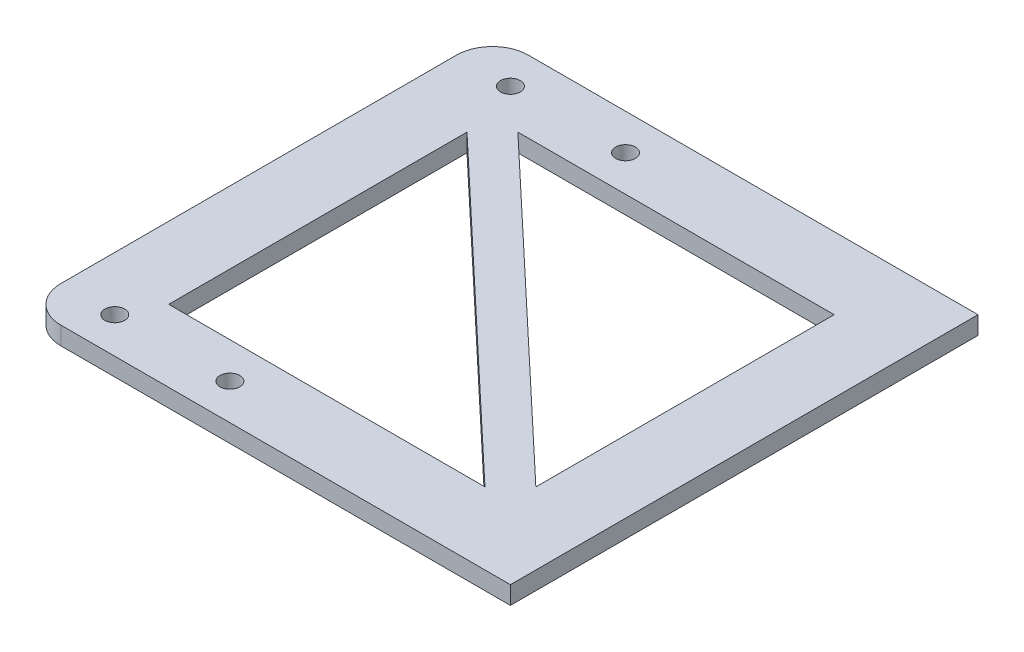
from build123d import *

# Parameters (mm, degrees)
SKETCH1_W           = 135
SKETCH1_H           = 130
SKETCH1_R           = 2.75
BOSS_EXTRUDE2_DEPTH = 5
FILLET1_R           = 10


with BuildPart() as part:
    # Sketch1 → Boss-Extrude2 (new body)
    with BuildSketch(Plane(origin=(0, 0, 0), x_dir=(1, 0, 0), z_dir=(0, 1, 0))):
        with Locations((67.5, 65)):
            Rectangle(SKETCH1_W, SKETCH1_H)
        with Locations(Location((15, 10, 0), (0, 0, 270))):
            Circle(SKETCH1_R, mode=Mode.SUBTRACT)
        with Locations(Location((47, 10, 0), (0, 0, 270))):
            Circle(SKETCH1_R, mode=Mode.SUBTRACT)
        with Locations(Location((15, 120, 0), (0, 0, 270))):
            Circle(SKETCH1_R, mode=Mode.SUBTRACT)
        with Locations(Location((47, 120, 0), (0, 0, 270))):
            Circle(SKETCH1_R, mode=Mode.SUBTRACT)
        Polygon((20, 102.925904836), (107.925904836, 20), (20, 20), align=None, mode=Mode.SUBTRACT)
        Polygon((27.074095164, 110), (115, 27.074095164), (115, 110), align=None, mode=Mode.SUBTRACT)
    extrude(amount=BOSS_EXTRUDE2_DEPTH)

    # Fillet1
    fillet1_edges = [part.edges().sort_by_distance(p)[0] for p in [
        (0, 2.5, 0),
        (0, 2.5, -130),
    ]]
    fillet(fillet1_edges, radius=FILLET1_R)


solid = part.part
